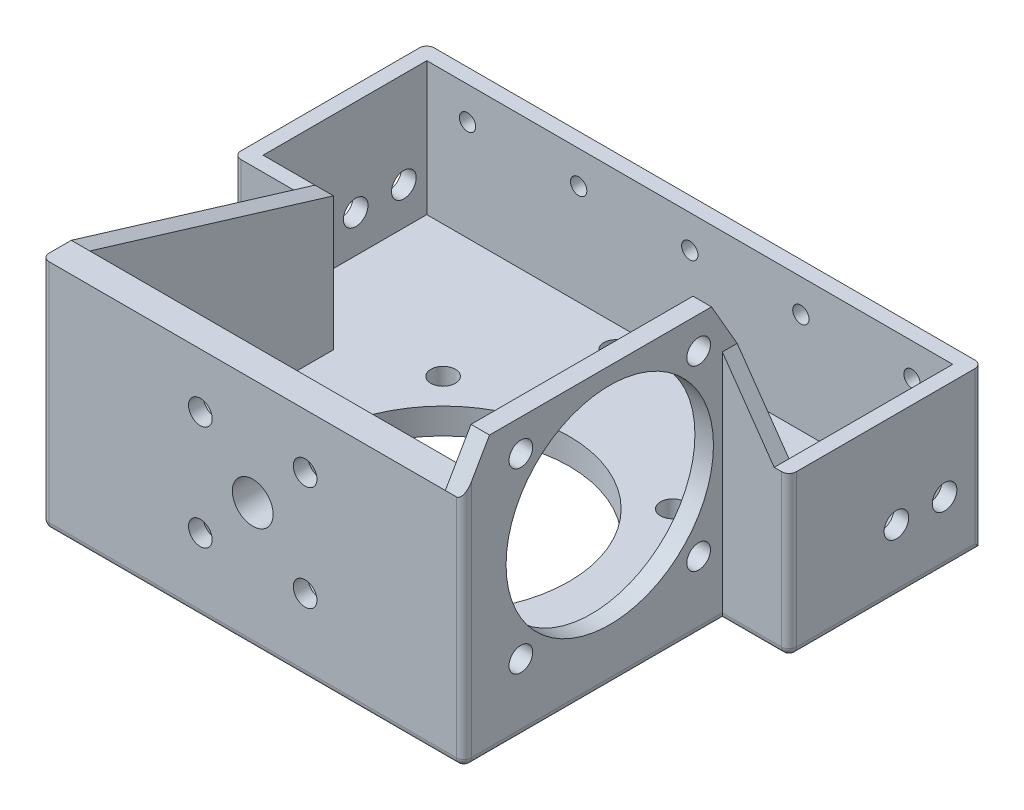
from build123d import *

# Parameters (mm, degrees)
SKETCH_2_R           = 1.6
SKETCH_2_R_2         = 17
SKETCH_2_R_3         = 1.65
EXTRUDE_2_DEPTH      = 3.5
EXTRUDE_3_DEPTH      = 18
EXTRUDE_4_DEPTH      = 10
CUT_EXTRUDE_5_DEPTH  = 3
SKETCH_10_R          = 2.75
SKETCH_10_R_2        = 1.6
CUT_EXTRUDE_4_DEPTH  = 5
SKETCH_14_R          = 1.55
SKETCH_14_R_2        = 1.1
CUT_EXTRUDE_6_DEPTH  = 10
CUT_EXTRUDE_7_DEPTH  = 2
EXTRUDE_6_DEPTH      = 2
EXTRUDE_7_DEPTH      = 2.5
SKETCH_21_R          = 1.6
SKETCH_21_R_2        = 14
CUT_EXTRUDE_8_DEPTH  = 3
FILLET_1_R           = 1
SKETCH_25_R          = 1.66119801
CUT_EXTRUDE_9_DEPTH  = 10
CUT_EXTRUDE_START    = -10
SKETCH_27_R          = 1.66119801
CUT_EXTRUDE_10_DEPTH = 10


with BuildPart() as part:
    # 草图2 → 凸台-拉伸2 (new body)
    with BuildSketch(Plane(origin=(0, 0, 0), x_dir=(1, 0, 0), z_dir=(0, 1, 0))):
        Polygon((-9, 34.9), (-9, 61), (6, 61), (51, 61), (66, 61), (66, 34.9), (57, 34.9), (57, 0), (0, 0), (0, 34.9), align=None)
        with Locations(Location((21.5, 56, 0), (0, 0, 270))):
            Circle(SKETCH_2_R, mode=Mode.SUBTRACT)
        with Locations(Location((35.5, 56, 0), (0, 0, 270))):
            Circle(SKETCH_2_R, mode=Mode.SUBTRACT)
        with Locations(Location((28.5, 25.7, 0), (0, 0, 270))):
            Circle(SKETCH_2_R_2, mode=Mode.SUBTRACT)
        with Locations(Location((44, 41.2, 0), (0, 0, 270))):
            Circle(SKETCH_2_R_3, mode=Mode.SUBTRACT)
        with Locations(Location((44, 10.2, 0), (0, 0, 270))):
            Circle(SKETCH_2_R_3, mode=Mode.SUBTRACT)
        with Locations(Location((13, 10.2, 0), (0, 0, 270))):
            Circle(SKETCH_2_R_3, mode=Mode.SUBTRACT)
        with Locations(Location((13, 41.2, 0), (0, 0, 270))):
            Circle(SKETCH_2_R_3, mode=Mode.SUBTRACT)
    extrude(amount=EXTRUDE_2_DEPTH)

    # 草图6 → 凸台-拉伸3 (add)
    with BuildSketch(Plane(origin=(0, 3.5, 0), x_dir=(1, 0, 0), z_dir=(0, 1, 0))):
        Polygon((66, 61), (-9, 61), (-9, 34.9), (0, 34.9), (0, 0), (57, 0), (57, 34.9), (66, 34.9), align=None)
        Polygon((15.5, 59), (-7, 59), (-7, 36.9), (2.5, 36.9), (2.5, 4), (54.5, 4), (54.5, 36.9), (64, 36.9), (64, 59), (41.5, 59), align=None, mode=Mode.SUBTRACT)
    extrude(amount=EXTRUDE_3_DEPTH)

    # 草图11 → 凸台-拉伸4 (add)
    with BuildSketch(Plane(origin=(0, 21.5, 0), x_dir=(1, 0, 0), z_dir=(0, 1, 0))):
        Polygon((2.5, 36.9), (2.5, 4), (54.5, 4), (54.5, 36.9), (57, 36.9), (57, 0), (0, 0), (0, 36.9), align=None)
    extrude(amount=EXTRUDE_4_DEPTH)

    # 草图12 → 切除-拉伸5 (cut)
    with BuildSketch(Plane.ZY):
        Polygon((-36.9, 21.5), (-4, 31.5), (-36.9, 31.5), align=None)
    extrude(amount=-CUT_EXTRUDE_5_DEPTH, mode=Mode.SUBTRACT)

    # 草图10 → 切除-拉伸4 (cut)
    with BuildSketch(Plane.XY):
        with Locations((28.5, 17.071067812)):
            Circle(SKETCH_10_R)
        with Locations((35.571067812, 24.142135624)):
            Circle(SKETCH_10_R_2)
        with Locations((35.571067812, 10)):
            Circle(SKETCH_10_R_2)
        with Locations((21.428932188, 10)):
            Circle(SKETCH_10_R_2)
        with Locations((21.428932188, 24.142135624)):
            Circle(SKETCH_10_R_2)
    extrude(amount=-CUT_EXTRUDE_4_DEPTH, mode=Mode.SUBTRACT)

    # 草图14 → 切除-拉伸6 (cut)
    with BuildSketch(Plane(origin=(0, 0, -61), x_dir=(-1, 0, 0), z_dir=(0, 0, -1))):
        with Locations((31.5, 17.071067812)):
            Circle(SKETCH_14_R)
        with Locations((-88.5, 17.071067812)):
            Circle(SKETCH_14_R)
        with Locations((-28.5, 17.071067812)):
            Circle(SKETCH_14_R_2)
        with Locations((-13.5, 17.071067812)):
            Circle(SKETCH_14_R_2)
        with Locations((1.5, 17.071067812)):
            Circle(SKETCH_14_R_2)
        with Locations((-43.5, 17.071067812)):
            Circle(SKETCH_14_R_2)
        with Locations((-58.5, 17.071067812)):
            Circle(SKETCH_14_R_2)
    extrude(amount=-CUT_EXTRUDE_6_DEPTH, mode=Mode.SUBTRACT)

    # 草图20 → 切除-拉伸7 (cut)
    with BuildSketch(Plane(origin=(0, 0, -4), x_dir=(-1, 0, 0), z_dir=(0, 0, -1))):
        Polygon((-24.428932188, 22.410084816), (-21.428932188, 20.678034009), (-18.428932188, 22.410084816), (-18.428932188, 25.874186431), (-21.428932188, 27.606237239), (-24.428932188, 25.874186431), align=None)
        Polygon((-33.839017004, 21.142135624), (-32.106966197, 24.142135624), (-33.839017004, 27.142135624), (-37.303118619, 27.142135624), (-39.035169427, 24.142135624), (-37.303118619, 21.142135624), align=None)
        Polygon((-23.160982996, 13), (-24.893033803, 10), (-23.160982996, 7), (-19.696881381, 7), (-17.964830573, 10), (-19.696881381, 13), align=None)
        Polygon((-32.571067812, 11.732050808), (-35.571067812, 13.464101615), (-38.571067812, 11.732050808), (-38.571067812, 8.267949192), (-35.571067812, 6.535898385), (-32.571067812, 8.267949192), align=None)
    extrude(amount=-CUT_EXTRUDE_7_DEPTH, mode=Mode.SUBTRACT)

    # 草图22 → 凸台-拉伸6 (add)
    with BuildSketch(Plane(origin=(0, 0, -36.9), x_dir=(-1, 0, 0), z_dir=(0, 0, -1))):
        Polygon((-57, 31.5), (-64.002075382, 21.5), (-57, 21.5), align=None)
    extrude(amount=-EXTRUDE_6_DEPTH)

    # 草图24 → 凸台-拉伸7 (add)
    with BuildSketch(Plane(origin=(57, 0, 0), x_dir=(0, 0, -1), z_dir=(1, 0, 0))):
        Polygon((0, 31.5), (3.464101615, 37.5), (33.435898385, 37.5), (36.9, 31.5), align=None)
    extrude(amount=-EXTRUDE_7_DEPTH)

    # 草图21 → 切除-拉伸8 (cut)
    with BuildSketch(Plane(origin=(57, 0, 0), x_dir=(0, 0, -1), z_dir=(1, 0, 0))):
        with Locations((7.7, 33.2)):
            Circle(SKETCH_21_R)
        with Locations((31.7, 33.2)):
            Circle(SKETCH_21_R)
        with Locations((31.7, 9.2)):
            Circle(SKETCH_21_R)
        with Locations((7.7, 9.2)):
            Circle(SKETCH_21_R)
        with Locations((19.7, 21.2)):
            Circle(SKETCH_21_R_2)
    extrude(amount=-CUT_EXTRUDE_8_DEPTH, mode=Mode.SUBTRACT)

    # 圆角1
    fillet_1_edges = [part.edges().sort_by_distance(p)[0] for p in [
        (66, 0, -47.95),
        (61.5, 0, -34.9),
        (57, 0, -17.45),
        (28.5, 0, 0),
        (0, 0, -17.45),
        (-4.5, 0, -34.9),
        (-9, 0, -47.95),
        (66, 10.75, -61),
        (66, 10.75, -34.9),
        (57, 15.75, 0),
        (0, 15.75, 0),
        (0, 10.75, -34.9),
        (-9, 10.75, -34.9),
        (-9, 10.75, -61),
    ]]
    fillet(fillet_1_edges, radius=FILLET_1_R)

    # 草图25 → 切除-拉伸9 (cut)
    with BuildSketch(Plane(origin=(66, 0, 0), x_dir=(0, 0, -1), z_dir=(1, 0, 0))):
        with Locations((55.9, 8.56)):
            Circle(SKETCH_25_R)
        with Locations((49.4, 8.56)):
            Circle(SKETCH_25_R)
    extrude(amount=-CUT_EXTRUDE_9_DEPTH, mode=Mode.SUBTRACT)

    # 草图27 → 切除-拉伸10 (cut)
    with BuildSketch(Plane.ZY.offset(9).offset(CUT_EXTRUDE_START)):
        with Locations(Location((-55.9, 8.56, 0), (0, 0, 180))):
            Circle(SKETCH_27_R)
        with Locations(Location((-49.4, 8.56, 0), (0, 0, 180))):
            Circle(SKETCH_27_R)
    extrude(amount=CUT_EXTRUDE_10_DEPTH, mode=Mode.SUBTRACT)


solid = part.part
